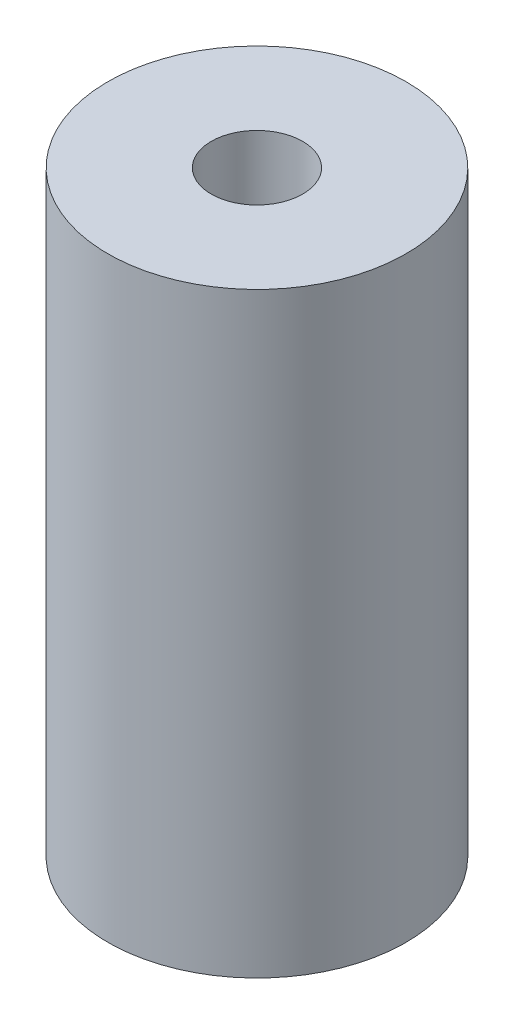
from build123d import *

# Parameters (mm, degrees)
SKETCH1_R           = 4.7625
SKETCH1_R_2         = 1.4605
BOSS_EXTRUDE1_DEPTH = 19.05


with BuildPart() as part:
    # Sketch1 → Boss-Extrude1 (new body)
    with BuildSketch(Plane(origin=(0, 0, 0), x_dir=(1, 0, 0), z_dir=(0, 1, 0))):
        with Locations(Location((0, 0, 0), (0, 0, 90))):
            Circle(SKETCH1_R)
        with Locations(Location((0, 0, 0), (0, 0, 90))):
            Circle(SKETCH1_R_2, mode=Mode.SUBTRACT)
    extrude(amount=BOSS_EXTRUDE1_DEPTH)


solid = part.part
